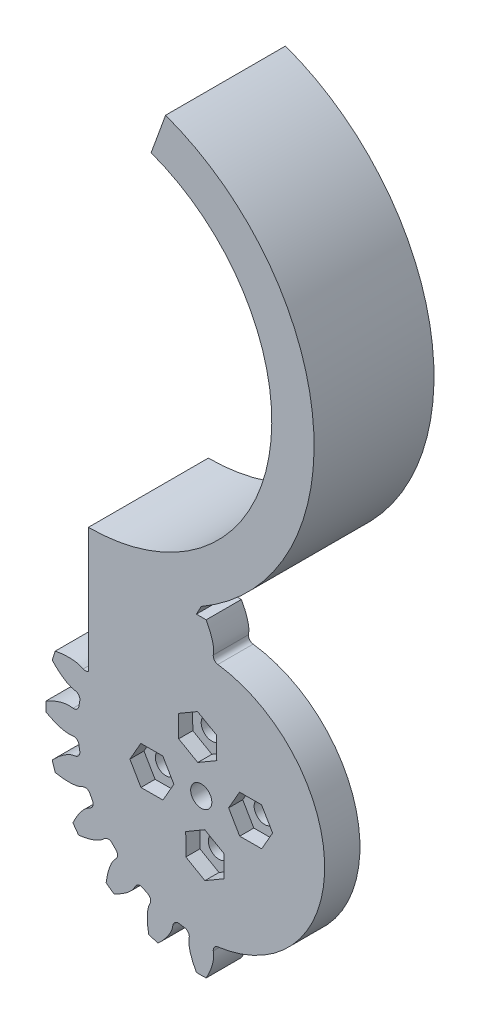
from build123d import *
from build123d.topology import SkipClean

# Parameters (mm, degrees)
SKETCH_1_R          = 22
LASHENA_DEPTH       = 5
CUT_EXTRUDEA_DEPTH  = 50
WWW_KYTOOL_CN_COUNT = 20
EXTRUDE_3_DEPTH     = 5
EXTRUDE_START       = 12
EXTRUDE_4_DEPTH     = 12
SKETCH_5_R          = 1.5
CUT_EXTRUDE_1_DEPTH = 85.855002753
CUT_EXTRUDE_2_DEPTH = 2


with BuildPart() as part:
    # 草图1 → LaShenA (new body)
    with BuildSketch(Plane.XY):
        Circle(SKETCH_1_R)
    extrude(amount=LASHENA_DEPTH)

    # SketchA → Cut-ExtrudeA (cut)
    with BuildSketch(Plane.XY.offset(5)):
        with BuildLine():
            ThreePointArc((-2.356349611, 17.340634836), (-2.737603138, 17.28454596), (-3.117529205, 17.220075832))
            ThreePointArc((-3.117529205, 17.220075832), (-3.673572605, 17.334949471), (-3.994833481, 17.803107206))
            add(Edge.make_bspline(
                [(-3.994833481, 17.803107206), (-4.034691495, 17.98253134), (-4.076537521, 18.219177773), (-4.157204778, 18.47396401), (-4.199055268, 18.580395528), (-4.234392911, 18.664311698), (-4.277870663, 18.759955155), (-4.330045748, 18.866984119), (-4.391601943, 18.984969425), (-4.463160419, 19.113474646), (-4.545339737, 19.2520309), (-4.638735544, 19.400145657), (-4.743925671, 19.557300848), (-4.861467358, 19.722954334), (-4.991896938, 19.896540395), (-5.135728792, 20.077470549), (-5.293454567, 20.265134311), (-5.465542346, 20.458900012), (-5.65243587, 20.658115632), (-5.854553762, 20.862109666), (-6.07228887, 21.070192005), (-6.3060073, 21.281654905), (-6.646489341, 21.573220913), (-6.916345556, 21.785433413), (-7.103559199, 21.924886291)],
                knots=[0.125068197, 0.125068197, 0.125068197, 0.125068197, 0.215847125, 0.244833276, 0.257593391, 0.272673526, 0.290073681, 0.309793857, 0.331834054, 0.356194271, 0.382874509, 0.411874767, 0.443195046, 0.476835345, 0.512795666, 0.551076006, 0.591676368, 0.634596749, 0.679837152, 0.727397575, 0.777278019, 0.829478483, 0.883998968, 1, 1, 1, 1], degree=3))
            ThreePointArc((-7.103559199, 21.924886291), (-3.605334877, 22.763188542), (-0.019276198, 23.046926489))
            add(Edge.make_bspline(
                [(-1.702150265, 18.166232554), (-1.719688148, 18.349191849), (-1.753017983, 18.587187115), (-1.755032138, 18.854430779), (-1.748119105, 18.96858568), (-1.740442532, 19.059314632), (-1.728648187, 19.16371233), (-1.712100501, 19.281625912), (-1.690016545, 19.412858516), (-1.661670688, 19.557187029), (-1.626329749, 19.714356663), (-1.583275034, 19.88408306), (-1.531796904, 20.066052064), (-1.471197858, 20.259920271), (-1.400793, 20.465315382), (-1.31991127, 20.681836671), (-1.227896436, 20.90905546), (-1.124108127, 21.146515641), (-1.007922835, 21.393734229), (-0.87873492, 21.650201949), (-0.735957506, 21.915383862), (-0.579023699, 22.188719998), (-0.345304887, 22.571230486), (-0.154233644, 22.856446723), (-0.019276198, 23.046926489)],
                knots=[0.125068197, 0.125068197, 0.125068197, 0.125068197, 0.215847125, 0.244833276, 0.257593391, 0.272673526, 0.290073681, 0.309793857, 0.331834054, 0.356194271, 0.382874509, 0.411874767, 0.443195046, 0.476835345, 0.512795666, 0.551076006, 0.591676368, 0.634596749, 0.679837152, 0.727397575, 0.777278019, 0.829478483, 0.883998968, 1, 1, 1, 1], degree=3))
            ThreePointArc((-1.702150265, 18.166232554), (-1.86301882, 17.621713019), (-2.356349611, 17.340634836))
        make_face()
    cut_extrudea = extrude(amount=-CUT_EXTRUDEA_DEPTH, mode=Mode.SUBTRACT)

    # www.KYTool.cn: Cut-ExtrudeA ×20 about axis
    www_kytool_cn_axis = Axis((0, 0, -88.99), (0, 0, 1))
    for i in range(1, WWW_KYTOOL_CN_COUNT):
        add(cut_extrudea.rotate(www_kytool_cn_axis, i * 360 / WWW_KYTOOL_CN_COUNT), mode=Mode.SUBTRACT)

    # 草图2 → 凸台-拉伸3 (add)
    with BuildSketch(Plane(origin=(0, 0, 0), x_dir=(-1, 0, 0), z_dir=(0, 0, -1))):
        with BuildLine():
            Line((16, 0), (16, 25))
            ThreePointArc((16, 25), (-9.605001578, 46.485147381), (7.107476274, 75.43200814))
            Line((7.107476274, 75.43200814), (5.055355414, 81.070163865))
            ThreePointArc((5.055355414, 81.070163865), (-15.878230339, 53.788983768), (0, 23.287187079))
            Line((0, 23.287187079), (0.692989583, 21.989082869))
            Line((0.692989583, 21.989082869), (0.692989583, 15.984985625))
            ThreePointArc((0.692989583, 15.984985625), (11.556120312, 11.06598768), (16, 0))
        make_face()
    extrude(amount=-EXTRUDE_3_DEPTH)

    # 草图3 → 凸台-拉伸4 (add)
    with BuildSketch(Plane(origin=(0, 0, 0), x_dir=(-1, 0, 0), z_dir=(0, 0, -1)).offset(EXTRUDE_START)):
        with BuildLine():
            Line((7.107476274, 75.43200814), (5.055355414, 81.070163865))
            ThreePointArc((5.055355414, 81.070163865), (-15.513848096, 45.443258315), (16, 19))
            Line((16, 19), (16, 25))
            ThreePointArc((16, 25), (-9.605001578, 46.485147381), (7.107476274, 75.43200814))
        make_face()
    extrude(amount=-EXTRUDE_4_DEPTH)

    # 草图5 → 切除-拉伸1 (cut, through all)
    with SkipClean():  # the faces are left unmerged after this step: merging them gives an invalid solid
        with BuildSketch(Plane(origin=(0, 0, 0), x_dir=(-1, 0, 0), z_dir=(0, 0, -1))):
            Circle(SKETCH_5_R)
            with Locations((0.507624465, 7)):
                Circle(SKETCH_5_R)
            with Locations((7, -0.507624465)):
                Circle(SKETCH_5_R)
            with Locations((-0.507624465, -7)):
                Circle(SKETCH_5_R)
            with Locations((-7, 0.507624465)):
                Circle(SKETCH_5_R)
            with BuildLine():
                Line((-2.737603138, 17.28454596), (-5.303981923, 23.594867186))
                Line((-5.303981923, 23.594867186), (-23.765494045, 14.490559838))
                Line((-23.765494045, 14.490559838), (-24.524186324, -9.113199953))
                Line((-24.524186324, -9.113199953), (-10.193332166, -21.926669553))
                Line((-10.193332166, -21.926669553), (-2.737603138, -21.926669553))
                Line((-2.737603138, -21.926669553), (-2.356349611, -17.340634836))
                ThreePointArc((-2.356349611, -17.340634836), (-17.498939252, -0.192678627), (-2.737603138, 17.28454596))
            make_face()
            Polygon((16, 13.234600946), (16, 9.475893134), (20.575854704, 10.191303591), (20.575854704, 14.490559838), align=None)
        extrude(amount=-CUT_EXTRUDE_1_DEPTH, mode=Mode.SUBTRACT)

    # 草图6 → 切除-拉伸2 (cut)
    with SkipClean():  # the faces are left unmerged after this step: merging them gives an invalid solid
        with BuildSketch(Plane.XY.offset(5)):
            Polygon((5.451941705, -2.198574994), (8.569608333, -2.186133074), (10.117666627, 0.520066385), (8.548058295, 3.213823925), (5.430391667, 3.201382005), (3.882333373, 0.495182545), align=None)
            Polygon((2.198574994, 5.451941705), (2.186133074, 8.569608333), (-0.520066385, 10.117666627), (-3.213823925, 8.548058295), (-3.201382005, 5.430391667), (-0.495182545, 3.882333373), align=None)
            Polygon((-2.198574994, -5.451941705), (-2.186133074, -8.569608333), (0.520066385, -10.117666627), (3.213823925, -8.548058295), (3.201382005, -5.430391667), (0.495182545, -3.882333373), align=None)
            Polygon((-5.451941705, 2.198574994), (-8.569608333, 2.186133074), (-10.117666627, -0.520066385), (-8.548058295, -3.213823925), (-5.430391667, -3.201382005), (-3.882333373, -0.495182545), align=None)
        extrude(amount=-CUT_EXTRUDE_2_DEPTH, mode=Mode.SUBTRACT)


solid = part.part
